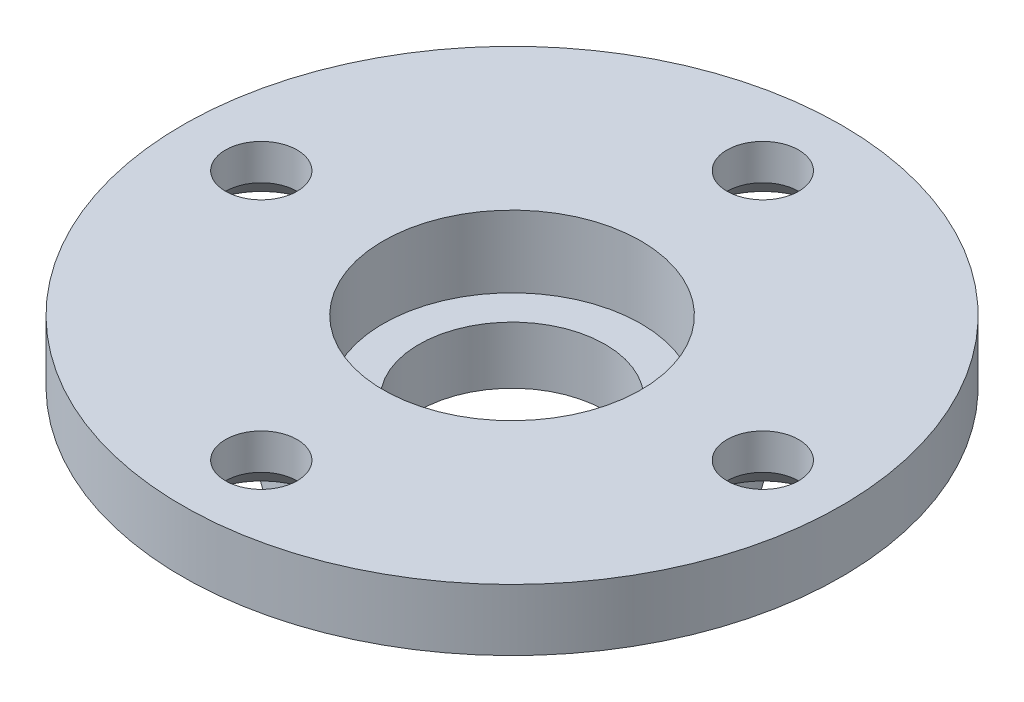
from build123d import *

# Parameters (mm, degrees)
FORO_SVASATO_PER_VITE_M5_1_D           = 5
FORO_SVASATO_PER_VITE_M5_1_CSINK_D     = 8.6
FORO_SVASATO_PER_VITE_M5_1_CSINK_ANGLE = 90
RIPETIZIONECIRCOLARE1_COUNT            = 4


with BuildPart() as part:
    # Schizzo1 → Rivoluzione1 (revolve)
    with BuildSketch(Plane.XY, mode=Mode.PRIVATE) as rivoluzione1_sk:
        Polygon((6.5, 0), (6.5, 4), (9, 4), (9, 9), (23, 9), (23, 4.7), (12.5, 4.7), (12.5, 0), align=None)
    revolve(rivoluzione1_sk.sketch.rotate(Axis((0, 0, 0), (0, 1, 0)), 90), axis=Axis((0, 0, 0), (0, 1, 0)))

    # Foro svasato per Vite M5-1 (through all)
    with Locations(Plane(origin=(0, 4.7, 0), x_dir=(-1, 0, 0), z_dir=(0, -1, 0))):
        with Locations((-17.5, 0)):
            foro_svasato_per_vite_m5_1 = CounterSinkHole(FORO_SVASATO_PER_VITE_M5_1_D / 2, FORO_SVASATO_PER_VITE_M5_1_CSINK_D / 2, counter_sink_angle=FORO_SVASATO_PER_VITE_M5_1_CSINK_ANGLE)

    # RipetizioneCircolare1: Foro svasato per Vite M5-1 ×4 about axis
    ripetizionecircolare1_axis = Axis((0, 0, 0), (0, 1, 0))
    for i in range(1, RIPETIZIONECIRCOLARE1_COUNT):
        add(foro_svasato_per_vite_m5_1.rotate(ripetizionecircolare1_axis, i * 360 / RIPETIZIONECIRCOLARE1_COUNT), mode=Mode.SUBTRACT)


solid = part.part
